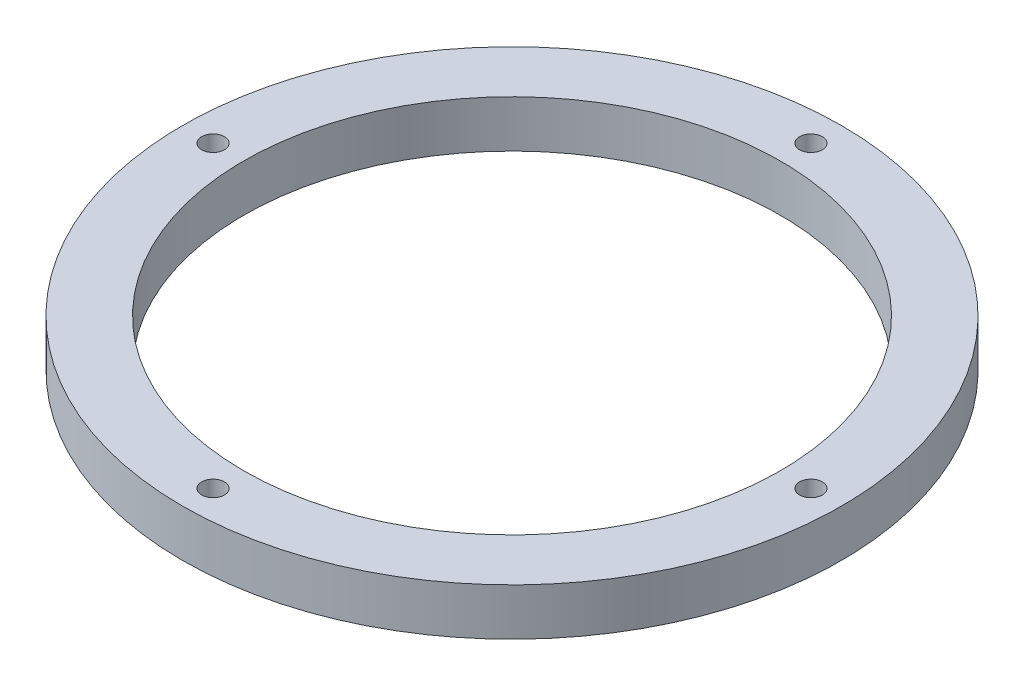
from build123d import *

# Parameters (mm, degrees)
SKETCH2_R           = 70
BOSS_EXTRUDE1_DEPTH = 10
SKETCH3_R           = 57
CUT_EXTRUDE1_DEPTH  = 10
SKETCH4_R           = 2.421505467
CUT_EXTRUDE2_DEPTH  = 10


with BuildPart() as part:
    # Sketch2 → Boss-Extrude1 (new body)
    with BuildSketch(Plane(origin=(0, 0, 0), x_dir=(1, 0, 0), z_dir=(0, 1, 0))):
        with Locations(Location((0, 0, 0), (0, 0, 270))):
            Circle(SKETCH2_R)
    extrude(amount=BOSS_EXTRUDE1_DEPTH)

    # Sketch3 → Cut-Extrude1 (cut)
    with BuildSketch(Plane(origin=(0, 10, 0), x_dir=(1, 0, 0), z_dir=(0, 1, 0))):
        with Locations(Location((0, 0, 0), (0, 0, 270))):
            Circle(SKETCH3_R)
    extrude(amount=-CUT_EXTRUDE1_DEPTH, mode=Mode.SUBTRACT)

    # Sketch4 → Cut-Extrude2 (cut)
    with BuildSketch(Plane(origin=(0, 10, 0), x_dir=(1, 0, 0), z_dir=(0, 1, 0))):
        with Locations(Location((-63.5, 0, 0), (0, 0, 270))):
            Circle(SKETCH4_R)
        with Locations(Location((0, 63.5, 0), (0, 0, 270))):
            Circle(SKETCH4_R)
        with Locations(Location((63.5, 0, 0), (0, 0, 270))):
            Circle(SKETCH4_R)
        with Locations(Location((0, -63.5, 0), (0, 0, 270))):
            Circle(SKETCH4_R)
    extrude(amount=-CUT_EXTRUDE2_DEPTH, mode=Mode.SUBTRACT)


solid = part.part
